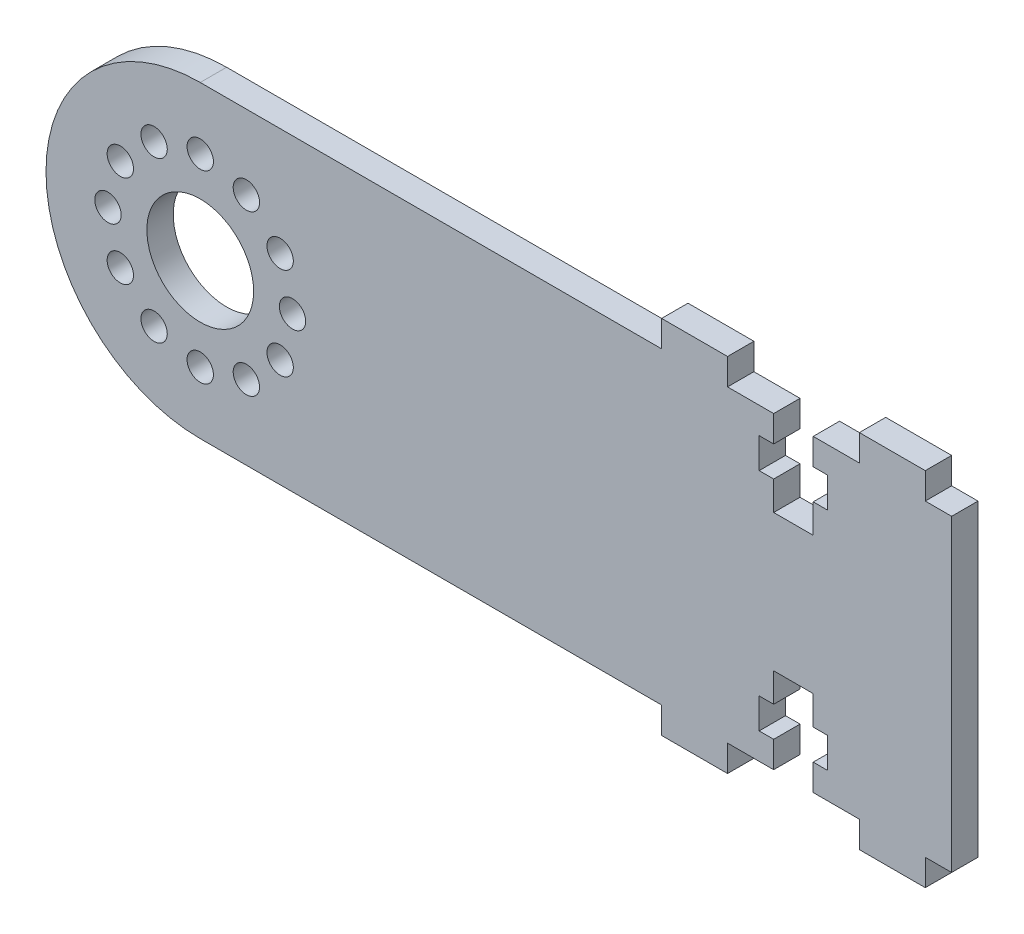
from build123d import *

# Parameters (mm, degrees)
SKETCH1_R           = 4.05
SKETCH1_R_2         = 1
BOSS_EXTRUDE1_DEPTH = 2


with BuildPart() as part:
    # Sketch1 → Boss-Extrude1 (new body)
    with BuildSketch(Plane.XY):
        with BuildLine():
            Line((57, 11.7), (57, -11.7))
            Line((57, -11.7), (55, -11.7))
            Line((55, -11.7), (55, -13.7))
            Line((55, -13.7), (50, -13.7))
            Line((50, -13.7), (50, -11.7))
            Line((50, -11.7), (46.5, -11.7))
            Line((46.5, -11.7), (46.5, -9.7))
            Line((46.5, -9.7), (47.6, -9.7))
            Line((47.6, -9.7), (47.6, -7.4))
            Line((47.6, -7.4), (46.5, -7.4))
            Line((46.5, -7.4), (46.5, -5.2))
            Line((46.5, -5.2), (43.5, -5.2))
            Line((43.5, -5.2), (43.5, -7.4))
            Line((43.5, -7.4), (42.4, -7.4))
            Line((42.4, -7.4), (42.4, -9.7))
            Line((42.4, -9.7), (43.5, -9.7))
            Line((43.5, -9.7), (43.5, -11.7))
            Line((43.5, -11.7), (40, -11.7))
            Line((40, -11.7), (40, -13.7))
            Line((40, -13.7), (35, -13.7))
            Line((35, -13.7), (35, -11.7))
            Line((35, -11.7), (0, -11.7))
            ThreePointArc((0, -11.7), (-11.7, 0), (0, 11.7))
            Line((0, 11.7), (35, 11.7))
            Line((35, 11.7), (35, 13.7))
            Line((35, 13.7), (40, 13.7))
            Line((40, 13.7), (40, 11.7))
            Line((40, 11.7), (43.5, 11.7))
            Line((43.5, 11.7), (43.5, 9.7))
            Line((43.5, 9.7), (42.4, 9.7))
            Line((42.4, 9.7), (42.4, 7.4))
            Line((42.4, 7.4), (43.5, 7.4))
            Line((43.5, 7.4), (43.5, 5.2))
            Line((43.5, 5.2), (46.5, 5.2))
            Line((46.5, 5.2), (46.5, 7.4))
            Line((46.5, 7.4), (47.6, 7.4))
            Line((47.6, 7.4), (47.6, 9.7))
            Line((47.6, 9.7), (46.5, 9.7))
            Line((46.5, 9.7), (46.5, 11.7))
            Line((46.5, 11.7), (50, 11.7))
            Line((50, 11.7), (50, 13.7))
            Line((50, 13.7), (55, 13.7))
            Line((55, 13.7), (55, 11.7))
            Line((55, 11.7), (57, 11.7))
        make_face()
        Circle(SKETCH1_R, mode=Mode.SUBTRACT)
        with Locations((7, 0)):
            Circle(SKETCH1_R_2, mode=Mode.SUBTRACT)
        with Locations((6.062177826, -3.5)):
            Circle(SKETCH1_R_2, mode=Mode.SUBTRACT)
        with Locations((3.5, -6.062177826)):
            Circle(SKETCH1_R_2, mode=Mode.SUBTRACT)
        with Locations((0, -7)):
            Circle(SKETCH1_R_2, mode=Mode.SUBTRACT)
        with Locations((-3.5, -6.062177826)):
            Circle(SKETCH1_R_2, mode=Mode.SUBTRACT)
        with Locations((-6.062177826, -3.5)):
            Circle(SKETCH1_R_2, mode=Mode.SUBTRACT)
        with Locations((-7, 0)):
            Circle(SKETCH1_R_2, mode=Mode.SUBTRACT)
        with Locations((-6.062177826, 3.5)):
            Circle(SKETCH1_R_2, mode=Mode.SUBTRACT)
        with Locations((-3.5, 6.062177826)):
            Circle(SKETCH1_R_2, mode=Mode.SUBTRACT)
        with Locations((0, 7)):
            Circle(SKETCH1_R_2, mode=Mode.SUBTRACT)
        with Locations((3.5, 6.062177826)):
            Circle(SKETCH1_R_2, mode=Mode.SUBTRACT)
        with Locations((6.062177826, 3.5)):
            Circle(SKETCH1_R_2, mode=Mode.SUBTRACT)
    extrude(amount=BOSS_EXTRUDE1_DEPTH)


solid = part.part
